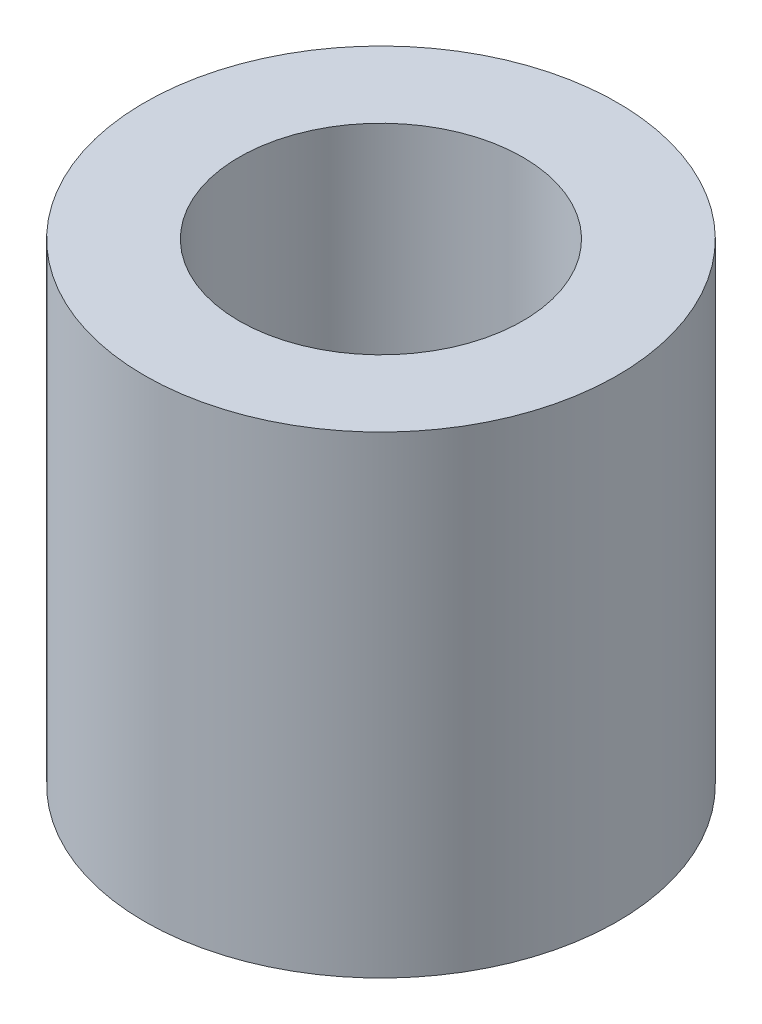
from build123d import *

# Parameters (mm, degrees)
SKETCH1_R           = 5
SKETCH1_R_2         = 3
BOSS_EXTRUDE1_DEPTH = 10


with BuildPart() as part:
    # Sketch1 → Boss-Extrude1 (new body)
    with BuildSketch(Plane(origin=(0, 0, 0), x_dir=(1, 0, 0), z_dir=(0, 1, 0))):
        with Locations(Location((0, 0, 0), (0, 0, 270))):
            Circle(SKETCH1_R)
        with Locations(Location((0, 0, 0), (0, 0, 270))):
            Circle(SKETCH1_R_2, mode=Mode.SUBTRACT)
    extrude(amount=BOSS_EXTRUDE1_DEPTH)


solid = part.part
